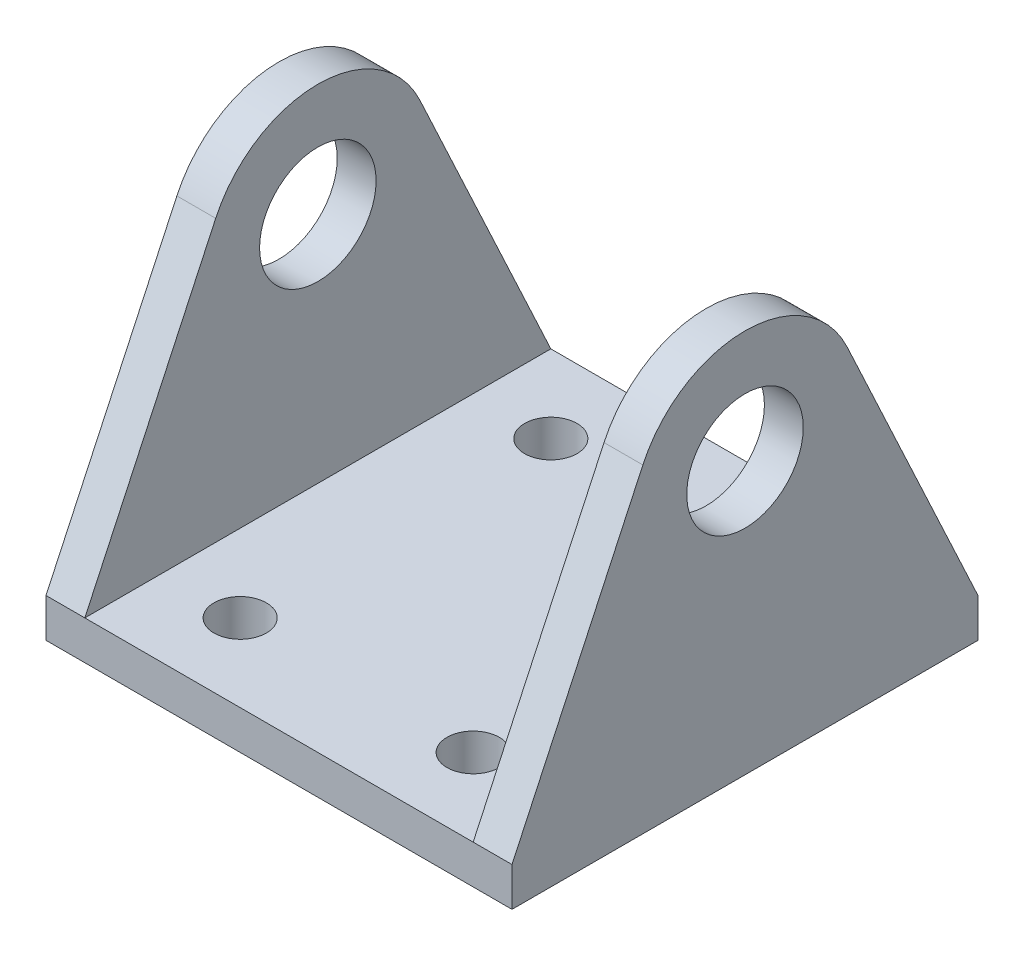
from build123d import *

# Parameters (mm, degrees)
ESQUISSE1_W             = 120
ESQUISSE1_H             = 120
BOSS_EXTRU_2_DEPTH      = 10
ESQUISSE2_R             = 15
BOSS_EXTRU_3_DEPTH      = 120
ESQUISSE3_W             = 100
ESQUISSE3_H             = 122.401822982
ENL_V_MAT_EXTRU_1_DEPTH = 197.482141726
ESQUISSE4_R             = 6.75
ENL_V_MAT_EXTRU_2_DEPTH = 10


with BuildPart() as part:
    # Esquisse1 → Boss.-Extru.2 (new body)
    with BuildSketch(Plane(origin=(0, 0, 0), x_dir=(1, 0, 0), z_dir=(0, 1, 0))):
        with Locations((60, 60)):
            Rectangle(ESQUISSE1_W, ESQUISSE1_H)
    extrude(amount=BOSS_EXTRU_2_DEPTH)

    # Esquisse2 → Boss.-Extru.3 (add)
    with BuildSketch(Plane(origin=(120, 0, 0), x_dir=(0, 0, -1), z_dir=(1, 0, 0))):
        with BuildLine():
            Line((86.302294997, 82.264961584), (120, 10))
            Line((120, 10), (0, 10))
            Line((0, 10), (33.697705003, 82.264961584))
            ThreePointArc((33.697705003, 82.264961584), (60, 99.021371518), (86.302294997, 82.264961584))
        make_face()
        with Locations((60, 70)):
            Circle(ESQUISSE2_R, mode=Mode.SUBTRACT)
    extrude(amount=-BOSS_EXTRU_3_DEPTH)

    # Esquisse3 → Enlèv. mat.-Extru.1 (cut, through all)
    with BuildSketch(Plane.XY):
        with Locations((60, 71.200911491)):
            Rectangle(ESQUISSE3_W, ESQUISSE3_H)
    extrude(amount=-ENL_V_MAT_EXTRU_1_DEPTH, mode=Mode.SUBTRACT)

    # Esquisse4 → Enlèv. mat.-Extru.2 (cut)
    with BuildSketch(Plane(origin=(0, 10, 0), x_dir=(1, 0, 0), z_dir=(0, 1, 0))):
        with Locations(Location((30, 20, 0), (0, 0, 270))):
            Circle(ESQUISSE4_R)
        with Locations(Location((30, 100, 0), (0, 0, 270))):
            Circle(ESQUISSE4_R)
        with Locations(Location((90, 100, 0), (0, 0, 270))):
            Circle(ESQUISSE4_R)
        with Locations(Location((90, 20, 0), (0, 0, 270))):
            Circle(ESQUISSE4_R)
    extrude(amount=-ENL_V_MAT_EXTRU_2_DEPTH, mode=Mode.SUBTRACT)


solid = part.part
